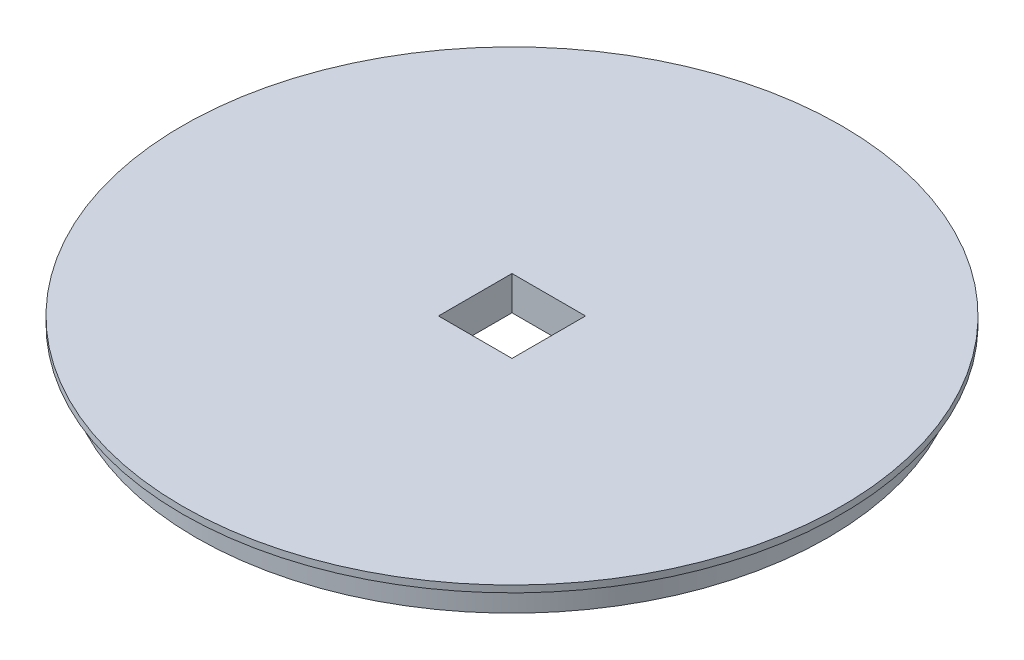
from build123d import *

# Parameters (mm, degrees)
SKETCH2_W          = 6.858
SKETCH2_H          = 6.858
CUT_EXTRUDE1_DEPTH = 44.580249391


with BuildPart() as part:
    # Sketch1 → Revolve1 (revolve)
    with BuildSketch(Plane.XY, mode=Mode.PRIVATE) as revolve1_sk:
        Polygon((0, 3.175), (-30.734, 3.175), (-30.734, 2.54), (-29.464, 2.54), (-29.464, 0), (0, 0), align=None)
    revolve(revolve1_sk.sketch.rotate(Axis((0, 0, 0), (0, 1, 0)), 270), axis=Axis((0, 0, 0), (0, 1, 0)))

    # Sketch2 → Cut-Extrude1 (cut, through all)
    with BuildSketch(Plane(origin=(0, 3.175, 0), x_dir=(1, 0, 0), z_dir=(0, 1, 0))):
        Rectangle(SKETCH2_W, SKETCH2_H)
    extrude(amount=-CUT_EXTRUDE1_DEPTH, mode=Mode.SUBTRACT)


solid = part.part
